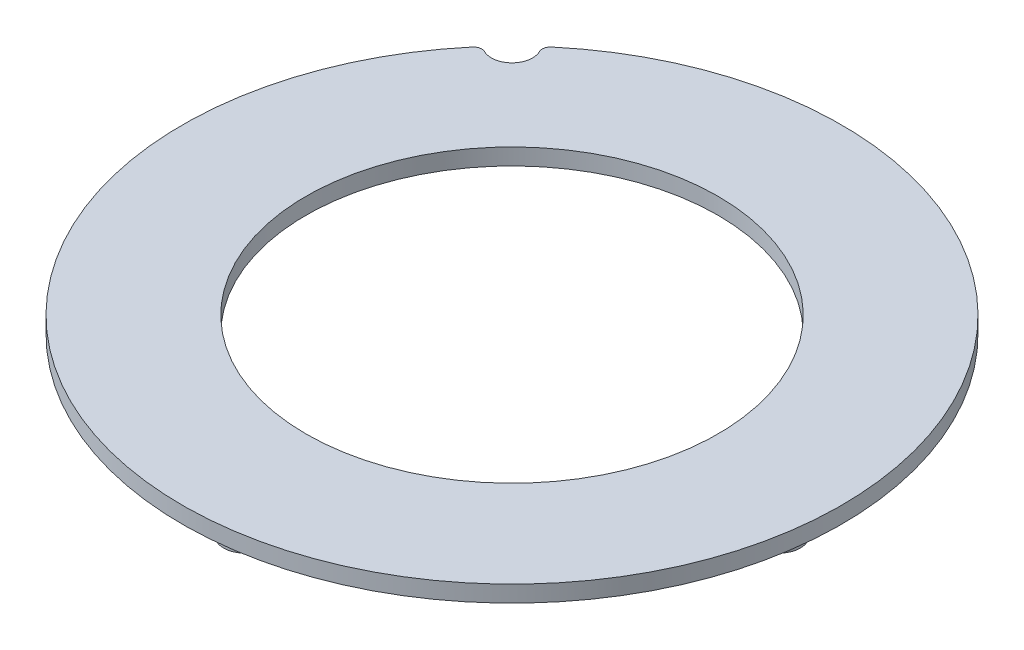
from build123d import *

# Parameters (mm, degrees)
SKETCH2_R           = 40
SKETCH2_R_2         = 25
BOSS_EXTRUDE2_DEPTH = 2
SKETCH4_R           = 2.5
BOSS_EXTRUDE3_DEPTH = 5
SKETCH5_R           = 2.5
CUT_EXTRUDE1_DEPTH  = 10
FILLET1_R           = 1
FILLET2_R           = 1


with BuildPart() as part:
    # Sketch2 → Boss-Extrude2 (new body)
    with BuildSketch(Plane(origin=(0, 0, 0), x_dir=(1, 0, 0), z_dir=(0, 1, 0))):
        with Locations(Location((0, 0, 0), (0, 0, 270))):
            Circle(SKETCH2_R)
        with Locations(Location((0, 0, 0), (0, 0, 270))):
            Circle(SKETCH2_R_2, mode=Mode.SUBTRACT)
    extrude(amount=BOSS_EXTRUDE2_DEPTH)

    # Sketch4 → Boss-Extrude3 (add)
    with BuildSketch(Plane.XZ):
        with Locations(Location((0, -32.5, 0), (0, 0, 90))):
            Circle(SKETCH4_R)
        with Locations(Location((32.5, 0, 0), (0, 0, 90))):
            Circle(SKETCH4_R)
        with Locations(Location((0, 32.5, 0), (0, 0, 90))):
            Circle(SKETCH4_R)
        with Locations(Location((-32.5, 0, 0), (0, 0, 90))):
            Circle(SKETCH4_R)
    extrude(amount=BOSS_EXTRUDE3_DEPTH)

    # Sketch5 → Cut-Extrude1 (cut)
    with BuildSketch(Plane(origin=(0, 2, 0), x_dir=(1, 0, 0), z_dir=(0, 1, 0))):
        with Locations((-28.284271247, 28.284271247)):
            Circle(SKETCH5_R)
    extrude(amount=-CUT_EXTRUDE1_DEPTH, mode=Mode.SUBTRACT)

    # Fillet1
    fillet1_edges = [part.edges().sort_by_distance(p)[0] for p in [
        (-26.462124956, 1, -29.995932105),
    ]]
    fillet(fillet1_edges, radius=FILLET1_R)

    # Fillet2
    fillet2_edges = [part.edges().sort_by_distance(p)[0] for p in [
        (-29.995932105, 1, -26.462124956),
    ]]
    fillet(fillet2_edges, radius=FILLET2_R)


solid = part.part
